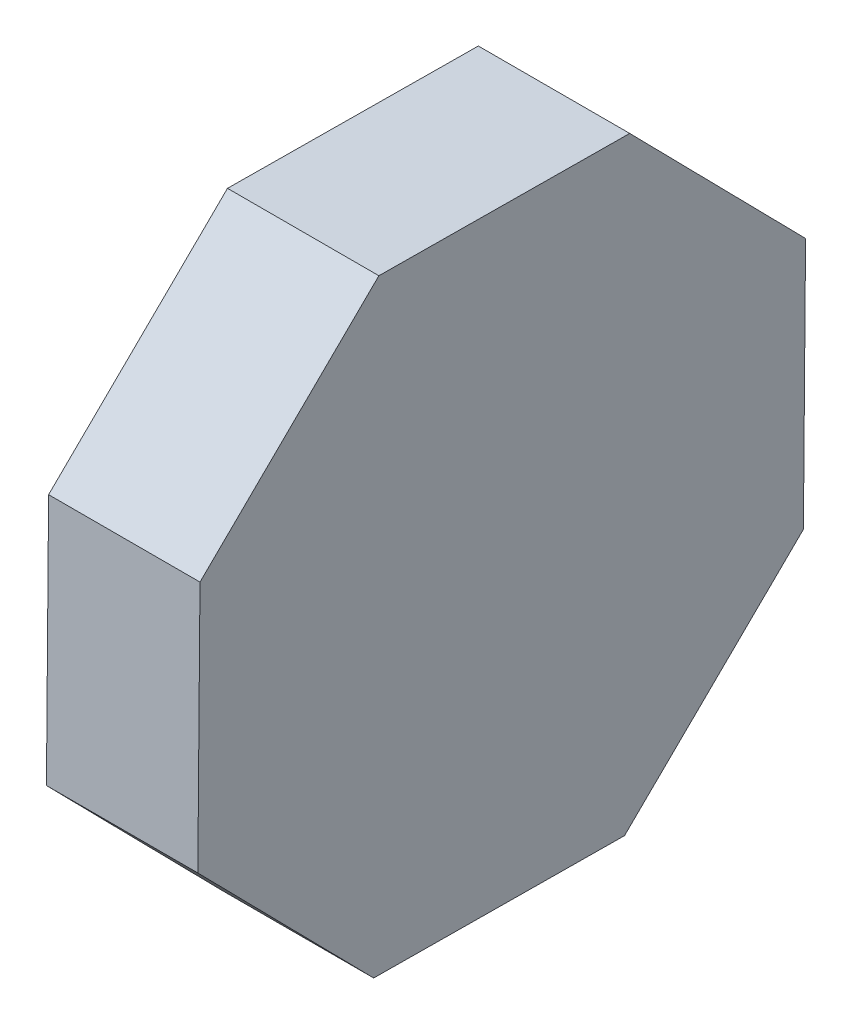
from build123d import *

# Parameters (mm, degrees)
BOSS_EXTRUDE1_DEPTH = 9.525
SKETCH2_R           = 4.23545
CUT_EXTRUDE1_DEPTH  = 4.7625


with BuildPart() as part:
    # Sketch1 → Boss-Extrude1 (new body)
    with BuildSketch(Plane(origin=(0, 0, 0), x_dir=(0, 0, -1), z_dir=(1, 0, 0))):
        Polygon((18.981321463, -8.05457391), (19.117264954, 7.726377291), (8.05457391, 18.981321463), (-7.726377291, 19.117264954), (-18.981321463, 8.05457391), (-19.117264954, -7.726377291), (-8.05457391, -18.981321463), (7.726377291, -19.117264954), align=None)
    extrude(amount=BOSS_EXTRUDE1_DEPTH)

    # Sketch2 → Cut-Extrude1 (cut)
    with BuildSketch(Plane.ZY):
        Circle(SKETCH2_R)
    extrude(amount=-CUT_EXTRUDE1_DEPTH, mode=Mode.SUBTRACT)


solid = part.part
